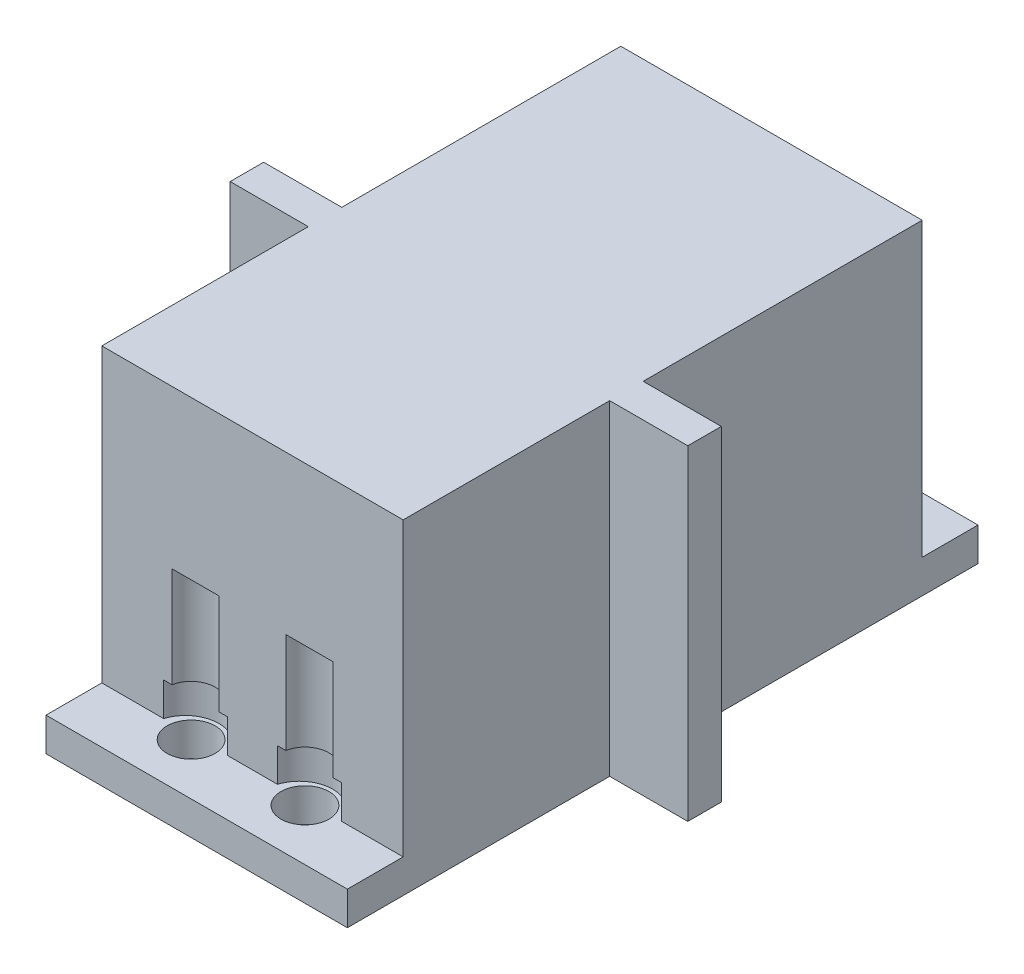
from build123d import *

# Parameters (mm, degrees)
BOSS_EXTRUDE1_DEPTH  = 3
SKETCH2_W            = 27
SKETCH2_H            = 3
BOSS_EXTRUDE2_DEPTH  = 5
SKETCH3_R            = 2.15
CUT_EXTRUDE1_DEPTH   = 15
SKETCH5_R            = 3
CUT_EXTRUDE3_DEPTH   = 3
SKETCH7_W            = 2
SKETCH7_H            = 29.15
BOSS_EXTRUDE6_DEPTH  = 43.5
SKETCH8_W            = 3
SKETCH8_H            = 29.15
BOSS_EXTRUDE7_DEPTH  = 25
SKETCH9_W            = 27
SKETCH9_H            = 3
BOSS_EXTRUDE8_DEPTH  = 5
SKETCH10_R           = 2.15
CUT_EXTRUDE4_DEPTH   = 15
SKETCH11_W           = 40.5
SKETCH11_H           = 1
BOSS_EXTRUDE9_DEPTH  = 23
SKETCH12_W           = 3
SKETCH12_H           = 29.15
BOSS_EXTRUDE10_DEPTH = 7


with BuildPart() as part:
    # Sketch1 → Boss-Extrude1 (new body)
    with BuildSketch(Plane.XY):
        Polygon((7.396868841, -30.545988075), (34.396868841, -30.545988075), (34.396868841, -3.045988075), (34.396868841, -1.395988075), (7.396868841, -1.395988075), (7.396868841, -3.045988075), align=None)
    extrude(amount=BOSS_EXTRUDE1_DEPTH)

    # Sketch2 → Boss-Extrude2 (add)
    with BuildSketch(Plane(origin=(0, 0, 0), x_dir=(-1, 0, 0), z_dir=(0, 0, -1))):
        with Locations((-20.896868841, -29.045988075)):
            Rectangle(SKETCH2_W, SKETCH2_H)
    extrude(amount=BOSS_EXTRUDE2_DEPTH)

    # Sketch3 → Cut-Extrude1 (cut)
    with BuildSketch(Plane.XZ.offset(30.545988075)):
        with Locations(Location((15.796868841, -0.9, 0), (0, 0, 270))):
            Circle(SKETCH3_R)
        with Locations(Location((25.996868841, -0.9, 0), (0, 0, 270))):
            Circle(SKETCH3_R)
    extrude(amount=-CUT_EXTRUDE1_DEPTH, mode=Mode.SUBTRACT)

    # Sketch5 → Cut-Extrude3 (cut)
    with BuildSketch(Plane(origin=(0, -27.545988075, 0), x_dir=(1, 0, 0), z_dir=(0, 1, 0))):
        with Locations((15.796868841, 0.9)):
            Circle(SKETCH5_R)
        with Locations((25.996868841, 0.9)):
            Circle(SKETCH5_R)
    cut_extrude3 = extrude(amount=CUT_EXTRUDE3_DEPTH, mode=Mode.SUBTRACT)

    # Sketch7 → Boss-Extrude6 (add)
    with BuildSketch(Plane.XY.offset(3)):
        with Locations((8.396868841, -15.970988075)):
            Rectangle(SKETCH7_W, SKETCH7_H)
    boss_extrude6 = extrude(amount=BOSS_EXTRUDE6_DEPTH)

    # Sketch8 → Boss-Extrude7 (add)
    with BuildSketch(Plane(origin=(9.396868841, 0, 0), x_dir=(0, 0, -1), z_dir=(1, 0, 0))):
        with Locations((-45, -15.970988075)):
            Rectangle(SKETCH8_W, SKETCH8_H)
    extrude(amount=BOSS_EXTRUDE7_DEPTH)

    # Sketch9 → Boss-Extrude8 (add)
    with BuildSketch(Plane.XY.offset(46.5)):
        with Locations((20.896868841, -29.045988075)):
            Rectangle(SKETCH9_W, SKETCH9_H)
    extrude(amount=BOSS_EXTRUDE8_DEPTH)

    # Sketch10 → Cut-Extrude4 (cut)
    with BuildSketch(Plane.XZ.offset(30.545988075)):
        with Locations(Location((25.996868841, 46.9, 0), (0, 0, 270))):
            Circle(SKETCH10_R)
        with Locations(Location((15.796868841, 46.9, 0), (0, 0, 270))):
            Circle(SKETCH10_R)
    extrude(amount=-CUT_EXTRUDE4_DEPTH, mode=Mode.SUBTRACT)

    # Mirror1: Cut-Extrude3 across plane
    add(cut_extrude3.mirror(Plane(origin=(0, 0, 23.25), x_dir=(1, 0, 0), z_dir=(0, 0, -1))), mode=Mode.SUBTRACT)

    # Mirror2: Boss-Extrude6 across plane
    add(boss_extrude6.mirror(Plane.ZY.offset(-20.896868841)))

    # Sketch11 → Boss-Extrude9 (add)
    with BuildSketch(Plane.ZY.offset(-32.396868841)):
        with Locations((23.25, -1.895988075)):
            Rectangle(SKETCH11_W, SKETCH11_H)
    extrude(amount=BOSS_EXTRUDE9_DEPTH)

    # Sketch12 → Boss-Extrude10 (add)
    with BuildSketch(Plane(origin=(34.396868841, 0, 0), x_dir=(0, 0, -1), z_dir=(1, 0, 0))):
        with Locations((-26.5, -15.970988075)):
            Rectangle(SKETCH12_W, SKETCH12_H)
    boss_extrude10 = extrude(amount=BOSS_EXTRUDE10_DEPTH)

    # Mirror3: Boss-Extrude10 across plane
    add(boss_extrude10.mirror(Plane.ZY.offset(-20.896868841)))


solid = part.part
